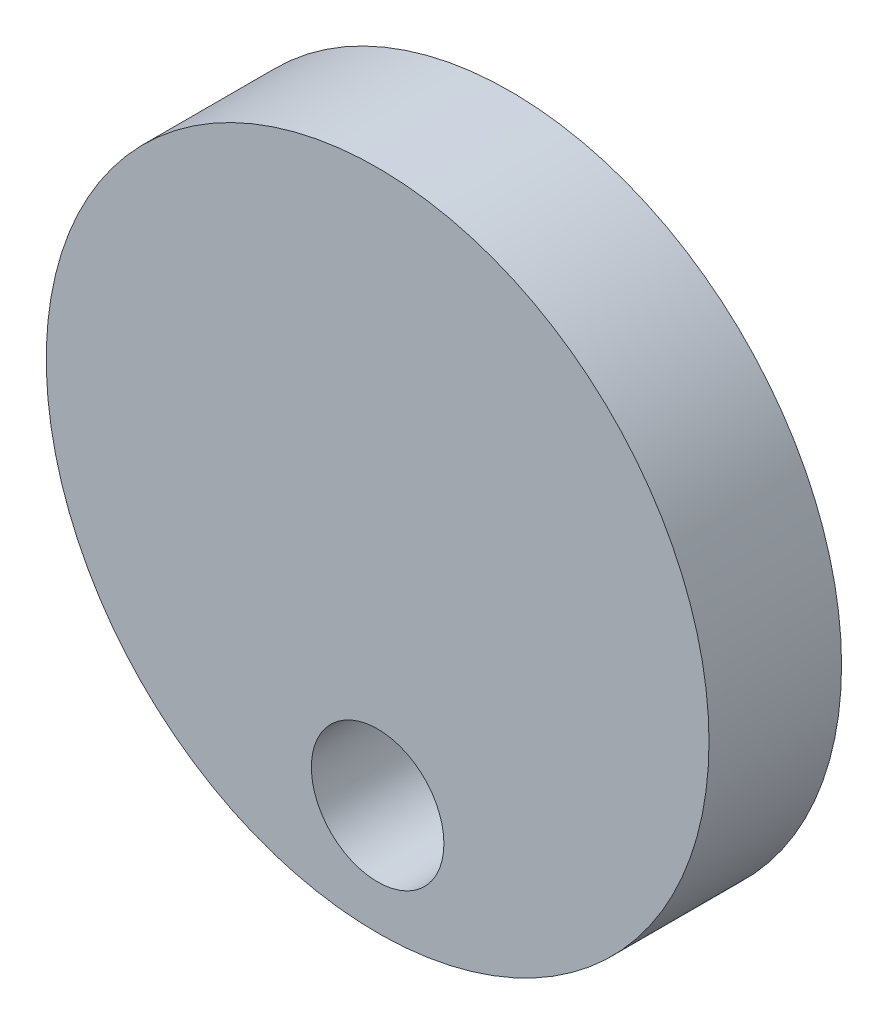
from build123d import *

# Parameters (mm, degrees)
SKETCH2_R           = 15
SKETCH2_R_2         = 3
BOSS_EXTRUDE1_DEPTH = 6


with BuildPart() as part:
    # Sketch2 → Boss-Extrude1 (new body)
    with BuildSketch(Plane.XY):
        Circle(SKETCH2_R)
        with Locations((0, -10)):
            Circle(SKETCH2_R_2, mode=Mode.SUBTRACT)
    extrude(amount=BOSS_EXTRUDE1_DEPTH)


solid = part.part
